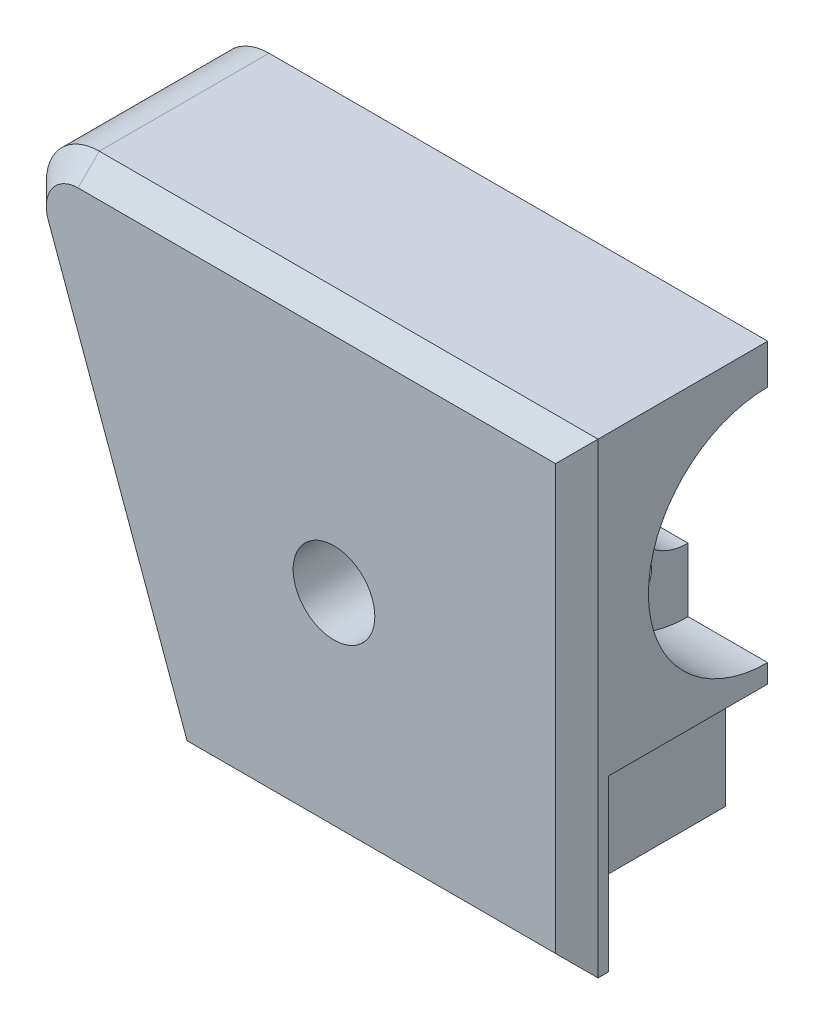
from build123d import *

# Parameters (mm, degrees)
BOSS_EXTRUDE1_DEPTH     = 15
BOSS_EXTRUDE2_DEPTH     = 3
BOSS_EXTRUDE3_DEPTH     = 15
CUT_EXTRUDE1_DEPTH      = 45.988887517
FILLET2_R               = 2
BOSS_EXTRUDE4_DEPTH     = 18
SKETCH8_R               = 2.2
CUT_EXTRUDE3_DEPTH      = 6
FILLET3_R               = 5
FILLET4_SIZE            = 2
CUT_EXTRUDE4_DEPTH      = 51.039984013
CUT_EXTRUDE4_DEPTH_BACK = 51.039984013
SKETCH9_R               = 2.1
SKETCH10_R              = 3.85
CUT_EXTRUDE5_DEPTH      = 8


with BuildPart() as part:
    # Sketch1 → Boss-Extrude1 (new body)
    with BuildSketch(Plane.XY):
        Polygon((0, 0), (30, 0), (30, -8), (2.911761874, -8), align=None)
    extrude(amount=BOSS_EXTRUDE1_DEPTH)

    # Sketch2 → Boss-Extrude2 (add)
    with BuildSketch(Plane.XY.offset(15)):
        Polygon((-11.425184054, 8), (-2.689898432, -16), (38, -16), (38, 8), align=None)
    extrude(amount=BOSS_EXTRUDE2_DEPTH)

    # Sketch3 → Boss-Extrude3 (add)
    with BuildSketch(Plane(origin=(0, 0, 0), x_dir=(-1, 0, 0), z_dir=(0, 0, -1))):
        Polygon((5.712592027, 4), (-34, 4), (-34, -12), (-34, -16), (-38, -16), (-38, 8), (11.425184054, 8), (2.689898432, -16), (-1.566812658, -16), (-0.110931721, -12), align=None)
    extrude(amount=-BOSS_EXTRUDE3_DEPTH)

    # Sketch4 → Cut-Extrude1 (cut, through all)
    with BuildSketch(Plane(origin=(0, 0, 0), x_dir=(-1, 0, 0), z_dir=(0, 0, -1))):
        Polygon((-38, 8), (-34, 8), (-34, -12), (4.145779369, -12), (4.145779369, -16), (-30, -16), (-38, -16), align=None)
    extrude(amount=-CUT_EXTRUDE1_DEPTH, mode=Mode.SUBTRACT)

    # Fillet2
    fillet2_edges = [part.edges().sort_by_distance(p)[0] for p in [
        (-5.712592027, 4, 7.5),
    ]]
    fillet(fillet2_edges, radius=FILLET2_R)

    # Sketch5 → Boss-Extrude4 (add)
    with BuildSketch(Plane(origin=(0, 0, 0), x_dir=(-1, 0, 0), z_dir=(0, 0, -1))):
        Polygon((11.425184054, 8), (20.160469676, 32), (-34, 32), (-34, 8), align=None)
    extrude(amount=-BOSS_EXTRUDE4_DEPTH)

    # Sketch7 → Cut-Revolve1 (revolve, cut)
    with BuildSketch(Plane(origin=(0, 0, 0), x_dir=(-1, 0, 0), z_dir=(0, 0, -1))):
        Polygon((-34, 17), (14.700916162, 17), (15.883819424, 20.25), (-15, 20.25), (-15, 22.25), (-26.5, 22.25), (-26.5, 28.25), (-34, 28.25), align=None)
    revolve(axis=Axis((34, 17, 0), (-1, 0, 0)), mode=Mode.SUBTRACT)

    # Sketch8 → Cut-Extrude3 (cut)
    with BuildSketch(Plane(origin=(26.5, 0, 0), x_dir=(0, 0, -1), z_dir=(1, 0, 0))):
        with Locations((-5.656854249, 22.656854249)):
            Circle(SKETCH8_R)
        with Locations((5.656854249, 22.656854249)):
            Circle(SKETCH8_R)
        with Locations((5.656854249, 11.343145751)):
            Circle(SKETCH8_R)
        with Locations((-5.656854249, 11.343145751)):
            Circle(SKETCH8_R)
    extrude(amount=-CUT_EXTRUDE3_DEPTH, mode=Mode.SUBTRACT)

    # Fillet3
    fillet3_edges = [part.edges().sort_by_distance(p)[0] for p in [
        (-20.160469676, 32, 9),
    ]]
    fillet(fillet3_edges, radius=FILLET3_R)

    # Fillet4
    fillet4_edges = [part.edges().sort_by_distance(p)[0] for p in [
        (10.490135179, 32, 18),
        (-10.931986058, 6.644949642, 18),
        (-17.115489864, 29.867882182, 18),
        (34, 10, 18),
        (14.927110316, -12, 18),
    ]]
    chamfer(fillet4_edges, length=FILLET4_SIZE)

    # Sketch9 → Cut-Extrude4 (cut, two sides: drawn at the far end of the back side and taken through both)
    with BuildSketch(Plane(origin=(0, 0, 0), x_dir=(-1, 0, 0), z_dir=(0, 0, -1)).offset(-CUT_EXTRUDE4_DEPTH_BACK)):
        with Locations((-11.105422856, 9)):
            Circle(SKETCH9_R)
    extrude(amount=CUT_EXTRUDE4_DEPTH + CUT_EXTRUDE4_DEPTH_BACK, mode=Mode.SUBTRACT)

    # Sketch10 → Cut-Extrude5 (cut)
    with BuildSketch(Plane.XY.offset(18)):
        with Locations((11.105422856, 9)):
            Circle(SKETCH10_R)
    extrude(amount=-CUT_EXTRUDE5_DEPTH, mode=Mode.SUBTRACT)


solid = part.part
